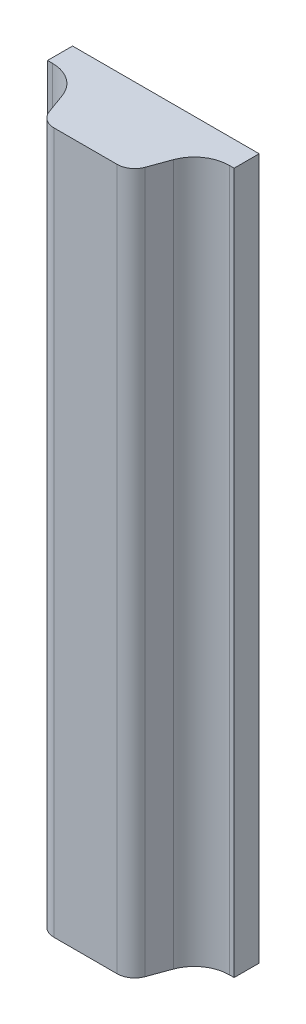
from build123d import *

# Parameters (mm, degrees)
EXTRUDE_1_DEPTH = 8


with BuildPart() as part:
    # 草图1 → 凸台-拉伸1 (new body)
    with BuildSketch(Plane(origin=(0, 0, 0), x_dir=(1, 0, 0), z_dir=(0, 1, 0))):
        with BuildLine():
            Line((4.181064308, -0.346153929), (4.266632429, -0.111057449))
            ThreePointArc((4.266632429, -0.111057449), (4.413078903, 0.079795311), (4.642509478, 0.152134494))
            Line((4.642509478, 0.152134494), (4.697815899, 0.152134494))
            Line((4.697815899, 0.152134494), (4.697815899, 0.43758725))
            Line((4.697815899, 0.43758725), (2.568518685, 0.43758725))
            Line((2.568518685, 0.43758725), (2.568518685, 0.152134494))
            Line((2.568518685, 0.152134494), (2.623825106, 0.152134494))
            ThreePointArc((2.623825106, 0.152134494), (2.853255681, 0.079795311), (2.999702154, -0.111057449))
            Line((2.999702154, -0.111057449), (3.085270275, -0.346153929))
            ThreePointArc((3.085270275, -0.346153929), (3.158493512, -0.441580309), (3.273208799, -0.477749901))
            Line((3.273208799, -0.477749901), (3.993125784, -0.477749901))
            ThreePointArc((3.993125784, -0.477749901), (4.107841071, -0.441580309), (4.181064308, -0.346153929))
        make_face()
    extrude(amount=EXTRUDE_1_DEPTH)


solid = part.part
